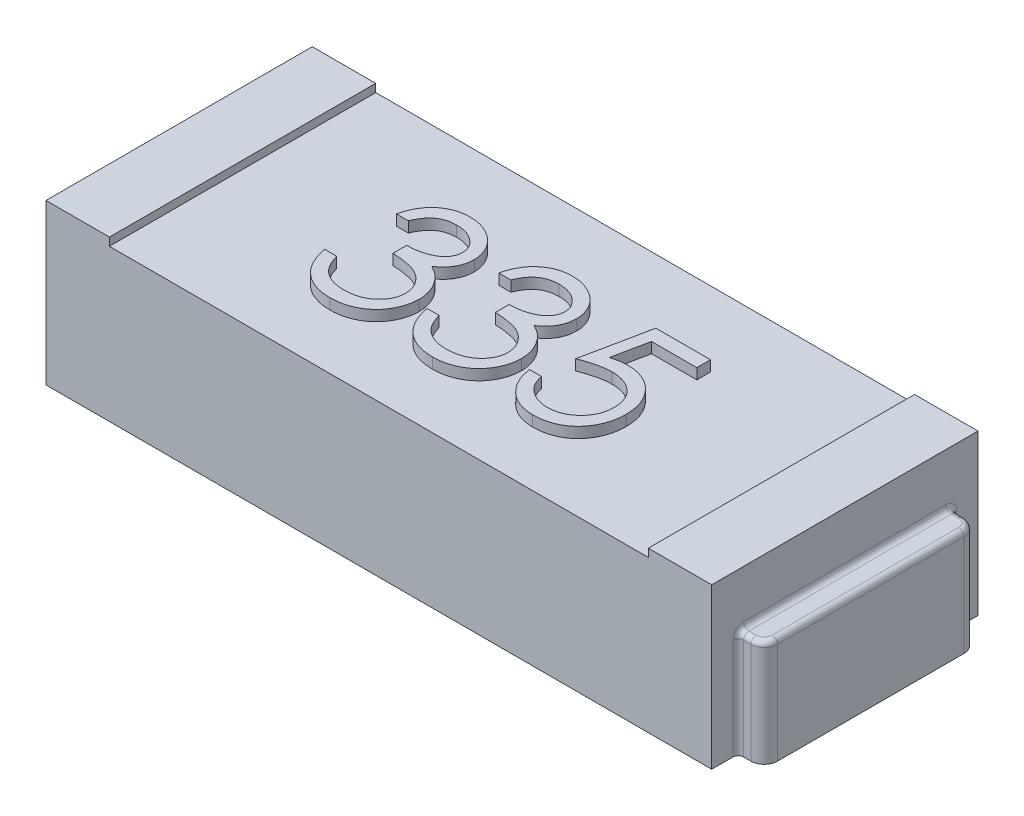
from build123d import *

# Parameters (mm, degrees)
ESQUISSE1_W             = 2.5
ESQUISSE1_H             = 1
BOSS_EXTRU_1_DEPTH      = 0.6
ESQUISSE2_W             = 2.023603034
ESQUISSE2_H             = 1
ENL_V_MAT_EXTRU_1_DEPTH = 0.03
BOSS_EXTRU_2_DEPTH      = 0.4
CONG_1_R                = 0.02
CONG_1_OF_SYM_TRIE2_R   = 0.02
BOSS_EXTRU_3_DEPTH      = 0.04


with BuildPart() as part:
    # Esquisse1 → Boss.-Extru.1 (new body)
    with BuildSketch(Plane(origin=(0, 0, 0), x_dir=(1, 0, 0), z_dir=(0, 1, 0))):
        Rectangle(ESQUISSE1_W, ESQUISSE1_H)
    extrude(amount=BOSS_EXTRU_1_DEPTH)

    # Esquisse2 → Enlèv. mat.-Extru.1 (cut)
    with BuildSketch(Plane(origin=(0, 0.6, 0), x_dir=(1, 0, 0), z_dir=(0, 1, 0))):
        Rectangle(ESQUISSE2_W, ESQUISSE2_H)
    extrude(amount=-ENL_V_MAT_EXTRU_1_DEPTH, mode=Mode.SUBTRACT)

    # Esquisse3 → Boss.-Extru.2 (add)
    with BuildSketch(Plane(origin=(0, 0, 0), x_dir=(1, 0, 0), z_dir=(0, 1, 0))):
        with BuildLine():
            Line((1.25, 0.4), (1.297141448, 0.4))
            ThreePointArc((1.297141448, 0.4), (1.332496787, 0.385355339), (1.347141448, 0.35))
            Line((1.347141448, 0.35), (1.347141448, -0.35))
            ThreePointArc((1.347141448, -0.35), (1.332496787, -0.385355339), (1.297141448, -0.4))
            Line((1.297141448, -0.4), (1.25, -0.4))
            Line((1.25, -0.4), (1.25, 0.4))
        make_face()
    boss_extru_2 = extrude(amount=BOSS_EXTRU_2_DEPTH)

    # Congé1
    cong_1_edges = [part.edges().sort_by_distance(p)[0] for p in [
        (1.25, 0.2, -0.4),
        (1.25, 0.2, 0.4),
        (1.25, 0.4, 0),
        (1.273570724, 0.4, 0.4),
        (1.332496787, 0.4, 0.385355339),
        (1.347141448, 0.4, 0),
        (1.332496787, 0.4, -0.385355339),
        (1.273570724, 0.4, -0.4),
    ]]
    fillet(cong_1_edges, radius=CONG_1_R)

    # Symétrie2: Boss.-Extru.2 across plane
    add(boss_extru_2.mirror(Plane(origin=(0, 0, 0), x_dir=(0, 0, 1), z_dir=(1, 0, 0))))

    # Congé1 of Symétrie2
    cong_1_of_sym_trie2_edges = [part.edges().sort_by_distance(p)[0] for p in [
        (-1.25, 0.2, -0.4),
        (-1.25, 0.2, 0.4),
        (-1.25, 0.4, 0),
        (-1.273570724, 0.4, 0.4),
        (-1.332496787, 0.4, 0.385355339),
        (-1.347141448, 0.4, 0),
        (-1.332496787, 0.4, -0.385355339),
        (-1.273570724, 0.4, -0.4),
    ]]
    fillet(cong_1_of_sym_trie2_edges, radius=CONG_1_OF_SYM_TRIE2_R)

    # Esquisse4 → Boss.-Extru.3 (add)
    with BuildSketch(Plane(origin=(0, 0.57, 0), x_dir=(1, 0, 0), z_dir=(0, 1, 0))):
        with BuildLine():
            Line((0.525641026, 0.219700477), (0.525641026, 0.168418426))
            Line((0.525641026, 0.168418426), (0.35556891, 0.168418426))
            Line((0.35556891, 0.168418426), (0.328625801, 0.036908009))
            add(Edge.make_bspline(
                [(0.328625801, 0.036908009), (0.333919498, 0.038369477), (0.344175197, 0.041200839), (0.35931232, 0.04434452), (0.373682635, 0.046239584), (0.383007688, 0.046498342), (0.387520032, 0.046623554)],
                knots=[0, 0, 0, 0, 1.100273476, 2.13160584, 3.095893838, 4, 4, 4, 4], degree=3))
            add(Edge.make_bspline(
                [(0.387520032, 0.046623554), (0.393103423, 0.046502706), (0.404081766, 0.046265089), (0.420144473, 0.043983396), (0.435477743, 0.04039198), (0.45004951, 0.035374763), (0.463886732, 0.028959086), (0.476862098, 0.020944809), (0.489170371, 0.011582905), (0.500590742, 0.000819332), (0.510951357, -0.011026614), (0.520060784, -0.023763452), (0.527798297, -0.037267404), (0.534021262, -0.051667491), (0.538990453, -0.066804513), (0.54229788, -0.082837739), (0.544500267, -0.099616042), (0.544746323, -0.111088123), (0.544871795, -0.116938144)],
                knots=[0, 0, 0, 0, 1.052922333, 2.070308379, 3.05430497, 4.020497103, 4.973039431, 5.925935799, 6.892292201, 7.88610001, 8.88166317, 9.857072816, 10.836096531, 11.812156883, 12.81219415, 13.836441305, 14.89672472, 16, 16, 16, 16], degree=3))
            add(Edge.make_bspline(
                [(0.544871795, -0.116938144), (0.544776784, -0.121012747), (0.544588047, -0.129106888), (0.543628248, -0.141127489), (0.541780289, -0.152893608), (0.539299185, -0.164406806), (0.53607884, -0.175645288), (0.532180404, -0.186641221), (0.527409543, -0.197326164), (0.522176489, -0.207801221), (0.516284135, -0.217829579), (0.509744348, -0.227208006), (0.502834992, -0.236077189), (0.495400509, -0.244342008), (0.487371795, -0.251948153), (0.478846086, -0.258940765), (0.469891412, -0.265438098), (0.460369234, -0.271176411), (0.450491736, -0.276456834), (0.440116277, -0.280788768), (0.429479034, -0.2846617), (0.418426909, -0.287748776), (0.406984936, -0.290167712), (0.395134253, -0.291810655), (0.382937015, -0.293007289), (0.374669156, -0.293082197), (0.370492788, -0.293120035)],
                knots=[0, 0, 0, 0, 1.056347294, 2.098418968, 3.122841568, 4.141288669, 5.149314143, 6.15115421, 7.162517403, 8.180376062, 9.185164535, 10.17417709, 11.141909838, 12.097768115, 13.052685741, 14.0056014, 14.954263652, 15.917497458, 16.885230207, 17.854509472, 18.828990115, 19.81800267, 20.826176721, 21.857883937, 22.917946725, 24, 24, 24, 24], degree=3))
            add(Edge.make_bspline(
                [(0.370492788, -0.293120035), (0.365510763, -0.293021344), (0.355709215, -0.292827181), (0.341349134, -0.290795969), (0.327532762, -0.287886838), (0.314371319, -0.283510228), (0.301746853, -0.278026329), (0.289829322, -0.271095447), (0.278314211, -0.26324129), (0.267669634, -0.253972668), (0.257790189, -0.243841856), (0.248946402, -0.232847907), (0.241070177, -0.221172273), (0.234287642, -0.208758251), (0.22850221, -0.19563846), (0.223957212, -0.181763746), (0.220288876, -0.167206603), (0.218736958, -0.157184673), (0.217948718, -0.152094394)],
                knots=[0, 0, 0, 0, 1.0467383, 2.05933395, 3.04377827, 4.011590433, 4.970194871, 5.932262533, 6.905835911, 7.896367577, 8.894135286, 9.877477877, 10.858688626, 11.851381753, 12.8477658, 13.868841284, 14.917554742, 16, 16, 16, 16], degree=3))
            Line((0.217948718, -0.152094394), (0.262820513, -0.152094394))
            add(Edge.make_bspline(
                [(0.262820513, -0.152094394), (0.263924592, -0.156862459), (0.266046695, -0.166026944), (0.270704659, -0.17890285), (0.276399784, -0.190377025), (0.283171834, -0.200601251), (0.29125041, -0.209516822), (0.300468899, -0.217462117), (0.310804288, -0.224629992), (0.322289035, -0.230604673), (0.33440519, -0.235700209), (0.34708622, -0.239093309), (0.359986841, -0.24147915), (0.368712322, -0.241717973), (0.373096955, -0.241837984)],
                knots=[0, 0, 0, 0, 1.136247022, 2.183929868, 3.172523383, 4.106158343, 5.02341133, 5.958108904, 6.928429099, 7.938127109, 8.96079061, 9.975095812, 10.982467395, 12, 12, 12, 12], degree=3))
            add(Edge.make_bspline(
                [(0.373096955, -0.241837984), (0.377376733, -0.24172073), (0.38580365, -0.241489856), (0.398205277, -0.239712854), (0.410178545, -0.236976058), (0.42160531, -0.232880365), (0.43268553, -0.227902548), (0.443138926, -0.22151468), (0.453267908, -0.214163249), (0.462757642, -0.205740873), (0.471448991, -0.196459488), (0.479128437, -0.186534146), (0.485525139, -0.175946025), (0.490915726, -0.164878432), (0.495009055, -0.153210067), (0.497929195, -0.140995613), (0.499643917, -0.128204902), (0.4998798, -0.119480715), (0.5, -0.1150351)],
                knots=[0, 0, 0, 0, 1.027316725, 2.022795036, 3.002884548, 3.971462791, 4.93288096, 5.914575861, 6.907176829, 7.935150275, 8.956128384, 9.956726525, 10.942570165, 11.921478529, 12.907843606, 13.90538589, 14.932640048, 16, 16, 16, 16], degree=3))
            add(Edge.make_bspline(
                [(0.5, -0.1150351), (0.499905932, -0.111024278), (0.499721806, -0.103173665), (0.498217439, -0.091688064), (0.495600728, -0.080820487), (0.491968745, -0.070518453), (0.487357387, -0.060772247), (0.4817222, -0.05157181), (0.474957429, -0.043038405), (0.467230016, -0.035168041), (0.458764582, -0.027904487), (0.449415475, -0.021712475), (0.439378343, -0.016503344), (0.428774115, -0.012007915), (0.417350558, -0.008779237), (0.405333896, -0.006355254), (0.392594366, -0.004953059), (0.383884268, -0.004758504), (0.379407051, -0.004658497)],
                knots=[0, 0, 0, 0, 1.045622112, 2.046656509, 3.013763289, 3.955457236, 4.890082067, 5.820317437, 6.762574623, 7.722996705, 8.69280354, 9.665887285, 10.63943826, 11.638615906, 12.663482002, 13.728887084, 14.832589034, 16, 16, 16, 16], degree=3))
            add(Edge.make_bspline(
                [(0.379407051, -0.004658497), (0.37553149, -0.004741439), (0.367529439, -0.004912692), (0.35525475, -0.00617362), (0.342355932, -0.008207805), (0.328882433, -0.01100584), (0.314793789, -0.014667423), (0.300119732, -0.019055209), (0.284829408, -0.024301208), (0.274526876, -0.028262953), (0.269230769, -0.030299523)],
                knots=[0, 0, 0, 0, 0.817624296, 1.688186739, 2.600797293, 3.572016777, 4.590301741, 5.671205678, 6.80286297, 8, 8, 8, 8], degree=3))
            Line((0.269230769, -0.030299523), (0.320512821, 0.219700477))
            Line((0.320512821, 0.219700477), (0.525641026, 0.219700477))
        make_face()
        with BuildLine():
            Line((-0.108974359, 0.104315862), (-0.153846154, 0.104315862))
            add(Edge.make_bspline(
                [(-0.153846154, 0.104315862), (-0.152630504, 0.109349074), (-0.150254007, 0.119188592), (-0.145297211, 0.133246772), (-0.139897317, 0.146550132), (-0.13341316, 0.158849571), (-0.12634048, 0.170392272), (-0.118237235, 0.180916432), (-0.109477274, 0.190689713), (-0.099787996, 0.199363033), (-0.089626758, 0.207216994), (-0.078850384, 0.213913431), (-0.067675685, 0.219674024), (-0.056025237, 0.224419771), (-0.043864356, 0.227994846), (-0.031302981, 0.230588676), (-0.018308195, 0.23227312), (-0.009487111, 0.232437515), (-0.005008013, 0.23252099)],
                knots=[0, 0, 0, 0, 1.162005537, 2.271625781, 3.343758855, 4.383309926, 5.390229558, 6.379919256, 7.361854164, 8.333198761, 9.295911338, 10.242430842, 11.177959212, 12.116337295, 13.062827104, 14.020064771, 14.994644689, 16, 16, 16, 16], degree=3))
            add(Edge.make_bspline(
                [(-0.005008013, 0.23252099), (0.001518093, 0.232323957), (0.014427952, 0.231934189), (0.033394101, 0.228374984), (0.051683647, 0.222742822), (0.069096397, 0.214960861), (0.085270459, 0.205362674), (0.099661342, 0.19393914), (0.112073987, 0.180910668), (0.122487469, 0.166520302), (0.130641041, 0.151140943), (0.13665338, 0.13531235), (0.14031362, 0.119072068), (0.140787985, 0.108106742), (0.141025641, 0.102613138)],
                knots=[0, 0, 0, 0, 1.083050992, 2.142477498, 3.193116406, 4.255571735, 5.30263384, 6.308962982, 7.297363603, 8.282367274, 9.249857812, 10.179914175, 11.08814088, 12, 12, 12, 12], degree=3))
            add(Edge.make_bspline(
                [(0.141025641, 0.102613138), (0.140859414, 0.097326453), (0.140534133, 0.086981231), (0.137772175, 0.07187816), (0.133124137, 0.057643645), (0.1266856, 0.044217765), (0.118351093, 0.031685645), (0.108254993, 0.020019089), (0.096326041, 0.009166352), (0.087286193, 0.002949285), (0.082632212, -0.000251446)],
                knots=[0, 0, 0, 0, 1.024540389, 2.004866551, 2.965041327, 3.920577974, 4.882998113, 5.874504559, 6.905732034, 8, 8, 8, 8], degree=3))
            add(Edge.make_bspline(
                [(0.082632212, -0.000251446), (0.087951034, -0.002819756), (0.098489159, -0.007908321), (0.11285352, -0.017887715), (0.125893216, -0.029410051), (0.133165176, -0.038401858), (0.13681891, -0.042919715)],
                knots=[0, 0, 0, 0, 1.015518401, 2.012035669, 3.001164323, 4, 4, 4, 4], degree=3))
            add(Edge.make_bspline(
                [(0.13681891, -0.042919715), (0.139224816, -0.046213679), (0.14399723, -0.052747668), (0.149888021, -0.063252871), (0.15523218, -0.073874513), (0.159396497, -0.084897285), (0.162621335, -0.09619343), (0.164926482, -0.107782343), (0.166358503, -0.119673489), (0.166563581, -0.127718129), (0.166666667, -0.131761862)],
                knots=[0, 0, 0, 0, 1.025084078, 2.033381695, 3.024893161, 4.013698104, 4.991890475, 5.976764909, 6.982997093, 8, 8, 8, 8], degree=3))
            add(Edge.make_bspline(
                [(0.166666667, -0.131761862), (0.166410308, -0.138763251), (0.165898796, -0.15273308), (0.161326785, -0.173372326), (0.154239179, -0.193547398), (0.144173903, -0.212843803), (0.131907116, -0.230898143), (0.117313212, -0.247051902), (0.100558011, -0.260937417), (0.08187149, -0.272538878), (0.061626186, -0.281812867), (0.03997253, -0.288249644), (0.017222522, -0.29244193), (0.00162148, -0.292891483), (-0.006310096, -0.293120035)],
                knots=[0, 0, 0, 0, 0.955779014, 1.907060117, 2.875433937, 3.871313158, 4.872415639, 5.851225146, 6.836215519, 7.83643374, 8.849228613, 9.86973379, 10.916971861, 12, 12, 12, 12], degree=3))
            add(Edge.make_bspline(
                [(-0.006310096, -0.293120035), (-0.01165571, -0.292996005), (-0.022174097, -0.292751954), (-0.037637454, -0.291083583), (-0.052397697, -0.288036439), (-0.066474782, -0.283935967), (-0.079881216, -0.278737147), (-0.092576088, -0.272263047), (-0.104637501, -0.264647118), (-0.115951637, -0.255799463), (-0.126517147, -0.245902128), (-0.13605325, -0.234779413), (-0.144718935, -0.222636926), (-0.152282169, -0.209333633), (-0.159087448, -0.195041453), (-0.164684728, -0.179577382), (-0.169611237, -0.163079664), (-0.171901732, -0.151582844), (-0.173076923, -0.145684138)],
                knots=[0, 0, 0, 0, 1.048658725, 2.063410685, 3.046034179, 4.001477787, 4.936774919, 5.862367409, 6.792675028, 7.730719943, 8.675894397, 9.627829632, 10.600096036, 11.597688215, 12.626045268, 13.701542398, 14.82072376, 16, 16, 16, 16], degree=3))
            Line((-0.173076923, -0.145684138), (-0.128205128, -0.145684138))
            add(Edge.make_bspline(
                [(-0.128205128, -0.145684138), (-0.127036087, -0.149533997), (-0.124762199, -0.157022307), (-0.120891585, -0.167799494), (-0.116481832, -0.177679216), (-0.111751181, -0.186733947), (-0.106782831, -0.195052862), (-0.101223556, -0.202415986), (-0.095485107, -0.209146729), (-0.091159485, -0.212938817), (-0.089042468, -0.214794715)],
                knots=[0, 0, 0, 0, 1.198163088, 2.33053128, 3.407730985, 4.417276592, 5.372219308, 6.28897303, 7.162600585, 8, 8, 8, 8], degree=3))
            add(Edge.make_bspline(
                [(-0.089042468, -0.214794715), (-0.086242957, -0.216953048), (-0.080652577, -0.221263053), (-0.071542829, -0.226763286), (-0.061962131, -0.231529146), (-0.051702892, -0.235169674), (-0.040986496, -0.238252197), (-0.02963973, -0.240269414), (-0.017762699, -0.241653439), (-0.009653018, -0.241775572), (-0.005508814, -0.241837984)],
                knots=[0, 0, 0, 0, 0.946170439, 1.889420265, 2.845303464, 3.807233317, 4.801018734, 5.828864929, 6.890507805, 8, 8, 8, 8], degree=3))
            add(Edge.make_bspline(
                [(-0.005508814, -0.241837984), (-0.000829742, -0.241749998), (0.008319779, -0.241577948), (0.021670473, -0.239995704), (0.034371537, -0.237691359), (0.046281955, -0.234132362), (0.057557742, -0.229735097), (0.068040834, -0.224213896), (0.07786885, -0.217736079), (0.086915907, -0.210373342), (0.09505098, -0.202313128), (0.102213768, -0.19388269), (0.108303005, -0.185117571), (0.113214945, -0.175969268), (0.117093595, -0.166475664), (0.119734052, -0.156610117), (0.121569983, -0.146453365), (0.121719499, -0.139549226), (0.121794872, -0.136068753)],
                knots=[0, 0, 0, 0, 1.217147791, 2.380027433, 3.494444702, 4.572153297, 5.609568379, 6.639424714, 7.649109417, 8.668170816, 9.669597737, 10.625200337, 11.543417969, 12.441394052, 13.322311151, 14.205496177, 15.095365482, 16, 16, 16, 16], degree=3))
            add(Edge.make_bspline(
                [(0.121794872, -0.136068753), (0.121576257, -0.131409991), (0.121140116, -0.122115647), (0.117810319, -0.108441707), (0.112333338, -0.095266934), (0.104665837, -0.082816107), (0.095332161, -0.071276693), (0.084422889, -0.060980767), (0.071847428, -0.052485039), (0.060273161, -0.046615231), (0.050020995, -0.042609935), (0.041247369, -0.039942083), (0.031424997, -0.037682989), (0.020672662, -0.035581236), (0.008909345, -0.033792472), (-0.003852146, -0.032300784), (-0.017614398, -0.031107207), (-0.027141707, -0.030574193), (-0.032051282, -0.030299523)],
                knots=[0, 0, 0, 0, 1.07054697, 2.135767047, 3.216561865, 4.33974944, 5.486079747, 6.621378074, 7.775625952, 8.963672916, 9.598146892, 10.304877434, 11.070270905, 11.915000392, 12.823868403, 13.805723172, 14.86925407, 16, 16, 16, 16], degree=3))
            Line((-0.032051282, -0.030299523), (-0.032051282, 0.020982529))
            add(Edge.make_bspline(
                [(-0.032051282, 0.020982529), (-0.025865401, 0.021087501), (-0.01374878, 0.021293115), (0.003950406, 0.023779974), (0.020875165, 0.027220063), (0.036650414, 0.032489376), (0.051028801, 0.038609419), (0.06350303, 0.045731163), (0.073898337, 0.053647556), (0.082164204, 0.062480786), (0.088382666, 0.071954364), (0.092929351, 0.081828172), (0.095615112, 0.092188752), (0.095973636, 0.099259419), (0.096153846, 0.102813458)],
                knots=[0, 0, 0, 0, 1.321986639, 2.589447074, 3.816329219, 5.01088745, 6.139805852, 7.153945165, 8.075214402, 8.924034688, 9.728124013, 10.488707548, 11.240355623, 12, 12, 12, 12], degree=3))
            add(Edge.make_bspline(
                [(0.096153846, 0.102813458), (0.096094645, 0.105424565), (0.095976866, 0.110619237), (0.09449154, 0.118208533), (0.092259535, 0.125565811), (0.089191002, 0.132659783), (0.085083831, 0.139441251), (0.08016869, 0.14596803), (0.074316104, 0.152202855), (0.067609612, 0.158014329), (0.060407925, 0.163552792), (0.0525151, 0.16825474), (0.044169118, 0.172275463), (0.035360739, 0.175591106), (0.026061377, 0.17808529), (0.016314726, 0.179876125), (0.0061022, 0.18099579), (-0.00086519, 0.181156992), (-0.004407051, 0.181238939)],
                knots=[0, 0, 0, 0, 0.884392785, 1.759457502, 2.611959086, 3.489218968, 4.37281399, 5.2945488, 6.255912374, 7.266815255, 8.301784654, 9.332968512, 10.37626691, 11.440494194, 12.520033166, 13.637162961, 14.798855837, 16, 16, 16, 16], degree=3))
            add(Edge.make_bspline(
                [(-0.004407051, 0.181238939), (-0.010100147, 0.181040173), (-0.021220086, 0.180651937), (-0.037250789, 0.177251506), (-0.052153551, 0.171826066), (-0.063544789, 0.16534992), (-0.071956585, 0.158957001), (-0.077967576, 0.153373803), (-0.083870506, 0.147169114), (-0.089277031, 0.139960774), (-0.094744742, 0.132236947), (-0.099722537, 0.123604993), (-0.104559636, 0.114290079), (-0.107474286, 0.107704989), (-0.108974359, 0.104315862)],
                knots=[0, 0, 0, 0, 1.472543308, 2.876219568, 4.221790263, 5.565193594, 6.249813518, 6.953379497, 7.687249741, 8.463570142, 9.283606569, 10.136032583, 11.040678096, 12, 12, 12, 12], degree=3))
        make_face()
        with BuildLine():
            Line((-0.493589744, 0.104315862), (-0.538461538, 0.104315862))
            add(Edge.make_bspline(
                [(-0.538461538, 0.104315862), (-0.537245888, 0.109349074), (-0.534869392, 0.119188592), (-0.529912596, 0.133246772), (-0.524512702, 0.146550132), (-0.518028544, 0.158849571), (-0.510955865, 0.170392272), (-0.502852619, 0.180916432), (-0.494092659, 0.190689713), (-0.48440338, 0.199363033), (-0.474242143, 0.207216994), (-0.463465769, 0.213913431), (-0.45229107, 0.219674024), (-0.440640622, 0.224419771), (-0.42847974, 0.227994846), (-0.415918366, 0.230588676), (-0.40292358, 0.23227312), (-0.394102495, 0.232437515), (-0.389623397, 0.23252099)],
                knots=[0, 0, 0, 0, 1.162005537, 2.271625781, 3.343758855, 4.383309926, 5.390229558, 6.379919256, 7.361854164, 8.333198761, 9.295911338, 10.242430842, 11.177959212, 12.116337295, 13.062827104, 14.020064771, 14.994644689, 16, 16, 16, 16], degree=3))
            add(Edge.make_bspline(
                [(-0.389623397, 0.23252099), (-0.383097291, 0.232323957), (-0.370187433, 0.231934189), (-0.351221283, 0.228374984), (-0.332931738, 0.222742822), (-0.315518988, 0.214960861), (-0.299344926, 0.205362674), (-0.284954042, 0.19393914), (-0.272541398, 0.180910668), (-0.262127915, 0.166520302), (-0.253974344, 0.151140943), (-0.247962005, 0.13531235), (-0.244301765, 0.119072068), (-0.2438274, 0.108106742), (-0.243589744, 0.102613138)],
                knots=[0, 0, 0, 0, 1.083050992, 2.142477498, 3.193116406, 4.255571735, 5.30263384, 6.308962982, 7.297363603, 8.282367274, 9.249857812, 10.179914175, 11.08814088, 12, 12, 12, 12], degree=3))
            add(Edge.make_bspline(
                [(-0.243589744, 0.102613138), (-0.243755971, 0.097326453), (-0.244081252, 0.086981231), (-0.24684321, 0.07187816), (-0.251491247, 0.057643645), (-0.257929785, 0.044217765), (-0.266264292, 0.031685645), (-0.276360392, 0.020019089), (-0.288289343, 0.009166352), (-0.297329192, 0.002949285), (-0.301983173, -0.000251446)],
                knots=[0, 0, 0, 0, 1.024540389, 2.004866551, 2.965041327, 3.920577974, 4.882998113, 5.874504559, 6.905732034, 8, 8, 8, 8], degree=3))
            add(Edge.make_bspline(
                [(-0.301983173, -0.000251446), (-0.296664351, -0.002819756), (-0.286126226, -0.007908321), (-0.271761865, -0.017887715), (-0.258722168, -0.029410051), (-0.251450208, -0.038401858), (-0.247796474, -0.042919715)],
                knots=[0, 0, 0, 0, 1.015518401, 2.012035669, 3.001164323, 4, 4, 4, 4], degree=3))
            add(Edge.make_bspline(
                [(-0.247796474, -0.042919715), (-0.245390568, -0.046213679), (-0.240618155, -0.052747668), (-0.234727364, -0.063252871), (-0.229383205, -0.073874513), (-0.225218888, -0.084897285), (-0.22199405, -0.09619343), (-0.219688902, -0.107782343), (-0.218256882, -0.119673489), (-0.218051803, -0.127718129), (-0.217948718, -0.131761862)],
                knots=[0, 0, 0, 0, 1.025084078, 2.033381695, 3.024893161, 4.013698104, 4.991890475, 5.976764909, 6.982997093, 8, 8, 8, 8], degree=3))
            add(Edge.make_bspline(
                [(-0.217948718, -0.131761862), (-0.218205077, -0.138763251), (-0.218716589, -0.15273308), (-0.223288599, -0.173372326), (-0.230376205, -0.193547398), (-0.240441482, -0.212843803), (-0.252708269, -0.230898143), (-0.267302172, -0.247051902), (-0.284057373, -0.260937417), (-0.302743895, -0.272538878), (-0.322989199, -0.281812867), (-0.344642855, -0.288249644), (-0.367392862, -0.29244193), (-0.382993905, -0.292891483), (-0.390925481, -0.293120035)],
                knots=[0, 0, 0, 0, 0.955779014, 1.907060117, 2.875433937, 3.871313158, 4.872415639, 5.851225146, 6.836215519, 7.83643374, 8.849228613, 9.86973379, 10.916971861, 12, 12, 12, 12], degree=3))
            add(Edge.make_bspline(
                [(-0.390925481, -0.293120035), (-0.396271095, -0.292996005), (-0.406789482, -0.292751954), (-0.422252838, -0.291083583), (-0.437013081, -0.288036439), (-0.451090167, -0.283935967), (-0.4644966, -0.278737147), (-0.477191473, -0.272263047), (-0.489252886, -0.264647118), (-0.500567022, -0.255799463), (-0.511132531, -0.245902128), (-0.520668635, -0.234779413), (-0.52933432, -0.222636926), (-0.536897554, -0.209333633), (-0.543702833, -0.195041453), (-0.549300112, -0.179577382), (-0.554226622, -0.163079664), (-0.556517117, -0.151582844), (-0.557692308, -0.145684138)],
                knots=[0, 0, 0, 0, 1.048658725, 2.063410685, 3.046034179, 4.001477787, 4.936774919, 5.862367409, 6.792675028, 7.730719943, 8.675894397, 9.627829632, 10.600096036, 11.597688215, 12.626045268, 13.701542398, 14.82072376, 16, 16, 16, 16], degree=3))
            Line((-0.557692308, -0.145684138), (-0.512820513, -0.145684138))
            add(Edge.make_bspline(
                [(-0.512820513, -0.145684138), (-0.511651471, -0.149533997), (-0.509377584, -0.157022307), (-0.50550697, -0.167799494), (-0.501097217, -0.177679216), (-0.496366565, -0.186733947), (-0.491398216, -0.195052862), (-0.485838941, -0.202415986), (-0.480100492, -0.209146729), (-0.47577487, -0.212938817), (-0.473657853, -0.214794715)],
                knots=[0, 0, 0, 0, 1.198163088, 2.33053128, 3.407730985, 4.417276592, 5.372219308, 6.28897303, 7.162600585, 8, 8, 8, 8], degree=3))
            add(Edge.make_bspline(
                [(-0.473657853, -0.214794715), (-0.470858342, -0.216953048), (-0.465267961, -0.221263053), (-0.456158214, -0.226763286), (-0.446577516, -0.231529146), (-0.436318277, -0.235169674), (-0.425601881, -0.238252197), (-0.414255114, -0.240269414), (-0.402378083, -0.241653439), (-0.394268403, -0.241775572), (-0.390124199, -0.241837984)],
                knots=[0, 0, 0, 0, 0.946170439, 1.889420265, 2.845303464, 3.807233317, 4.801018734, 5.828864929, 6.890507805, 8, 8, 8, 8], degree=3))
            add(Edge.make_bspline(
                [(-0.390124199, -0.241837984), (-0.385445127, -0.241749998), (-0.376295606, -0.241577948), (-0.362944912, -0.239995704), (-0.350243848, -0.237691359), (-0.33833343, -0.234132362), (-0.327057643, -0.229735097), (-0.31657455, -0.224213896), (-0.306746535, -0.217736079), (-0.297699477, -0.210373342), (-0.289564405, -0.202313128), (-0.282401617, -0.19388269), (-0.27631238, -0.185117571), (-0.27140044, -0.175969268), (-0.26752179, -0.166475664), (-0.264881333, -0.156610117), (-0.263045402, -0.146453365), (-0.262895886, -0.139549226), (-0.262820513, -0.136068753)],
                knots=[0, 0, 0, 0, 1.217147791, 2.380027433, 3.494444702, 4.572153297, 5.609568379, 6.639424714, 7.649109417, 8.668170816, 9.669597737, 10.625200337, 11.543417969, 12.441394052, 13.322311151, 14.205496177, 15.095365482, 16, 16, 16, 16], degree=3))
            add(Edge.make_bspline(
                [(-0.262820513, -0.136068753), (-0.263039127, -0.131409991), (-0.263475269, -0.122115647), (-0.266805066, -0.108441707), (-0.272282046, -0.095266934), (-0.279949548, -0.082816107), (-0.289283223, -0.071276693), (-0.300192496, -0.060980767), (-0.312767957, -0.052485039), (-0.324342224, -0.046615231), (-0.334594389, -0.042609935), (-0.343368016, -0.039942083), (-0.353190387, -0.037682989), (-0.363942723, -0.035581236), (-0.37570604, -0.033792472), (-0.388467531, -0.032300784), (-0.402229782, -0.031107207), (-0.411757092, -0.030574193), (-0.416666667, -0.030299523)],
                knots=[0, 0, 0, 0, 1.07054697, 2.135767047, 3.216561865, 4.33974944, 5.486079747, 6.621378074, 7.775625952, 8.963672916, 9.598146892, 10.304877434, 11.070270905, 11.915000392, 12.823868403, 13.805723172, 14.86925407, 16, 16, 16, 16], degree=3))
            Line((-0.416666667, -0.030299523), (-0.416666667, 0.020982529))
            add(Edge.make_bspline(
                [(-0.416666667, 0.020982529), (-0.410480786, 0.021087501), (-0.398364165, 0.021293115), (-0.380664979, 0.023779974), (-0.36374022, 0.027220063), (-0.347964971, 0.032489376), (-0.333586583, 0.038609419), (-0.321112354, 0.045731163), (-0.310717048, 0.053647556), (-0.30245118, 0.062480786), (-0.296232719, 0.071954364), (-0.291686034, 0.081828172), (-0.289000273, 0.092188752), (-0.288641749, 0.099259419), (-0.288461538, 0.102813458)],
                knots=[0, 0, 0, 0, 1.321986639, 2.589447074, 3.816329219, 5.01088745, 6.139805852, 7.153945165, 8.075214402, 8.924034688, 9.728124013, 10.488707548, 11.240355623, 12, 12, 12, 12], degree=3))
            add(Edge.make_bspline(
                [(-0.288461538, 0.102813458), (-0.28852074, 0.105424565), (-0.288638519, 0.110619237), (-0.290123844, 0.118208533), (-0.29235585, 0.125565811), (-0.295424383, 0.132659783), (-0.299531554, 0.139441251), (-0.304446695, 0.14596803), (-0.310299281, 0.152202855), (-0.317005773, 0.158014329), (-0.32420746, 0.163552792), (-0.332100285, 0.16825474), (-0.340446267, 0.172275463), (-0.349254646, 0.175591106), (-0.358554007, 0.17808529), (-0.368300658, 0.179876125), (-0.378513185, 0.18099579), (-0.385480575, 0.181156992), (-0.389022436, 0.181238939)],
                knots=[0, 0, 0, 0, 0.884392785, 1.759457502, 2.611959086, 3.489218968, 4.37281399, 5.2945488, 6.255912374, 7.266815255, 8.301784654, 9.332968512, 10.37626691, 11.440494194, 12.520033166, 13.637162961, 14.798855837, 16, 16, 16, 16], degree=3))
            add(Edge.make_bspline(
                [(-0.389022436, 0.181238939), (-0.394715531, 0.181040173), (-0.405835471, 0.180651937), (-0.421866173, 0.177251506), (-0.436768935, 0.171826066), (-0.448160173, 0.16534992), (-0.45657197, 0.158957001), (-0.462582961, 0.153373803), (-0.468485891, 0.147169114), (-0.473892416, 0.139960774), (-0.479360127, 0.132236947), (-0.484337922, 0.123604993), (-0.48917502, 0.114290079), (-0.49208967, 0.107704989), (-0.493589744, 0.104315862)],
                knots=[0, 0, 0, 0, 1.472543308, 2.876219568, 4.221790263, 5.565193594, 6.249813518, 6.953379497, 7.687249741, 8.463570142, 9.283606569, 10.136032583, 11.040678096, 12, 12, 12, 12], degree=3))
        make_face()
    extrude(amount=BOSS_EXTRU_3_DEPTH)


solid = part.part
